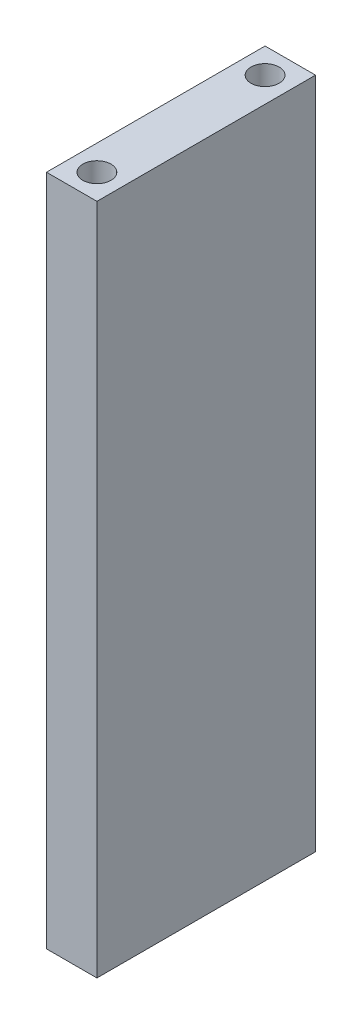
from build123d import *

# Parameters (mm, degrees)
SKETCH1_W           = 7.62
SKETCH1_H           = 33.02
SKETCH1_R           = 2.12725
BOSS_EXTRUDE1_DEPTH = 50.8


with BuildPart() as part:
    # Sketch1 → Boss-Extrude1 (new, symmetric)
    with BuildSketch(Plane(origin=(0, 0, 0), x_dir=(1, 0, 0), z_dir=(0, 1, 0))):
        with Locations((-142.038308124, -19.2875)):
            Rectangle(SKETCH1_W, SKETCH1_H)
        with Locations(Location((-142.038308124, -6.5875, 0), (0, 0, 270))):
            Circle(SKETCH1_R, mode=Mode.SUBTRACT)
        with Locations(Location((-142.038308124, -31.9875, 0), (0, 0, 270))):
            Circle(SKETCH1_R, mode=Mode.SUBTRACT)
    extrude(amount=BOSS_EXTRUDE1_DEPTH, both=True)


solid = part.part
